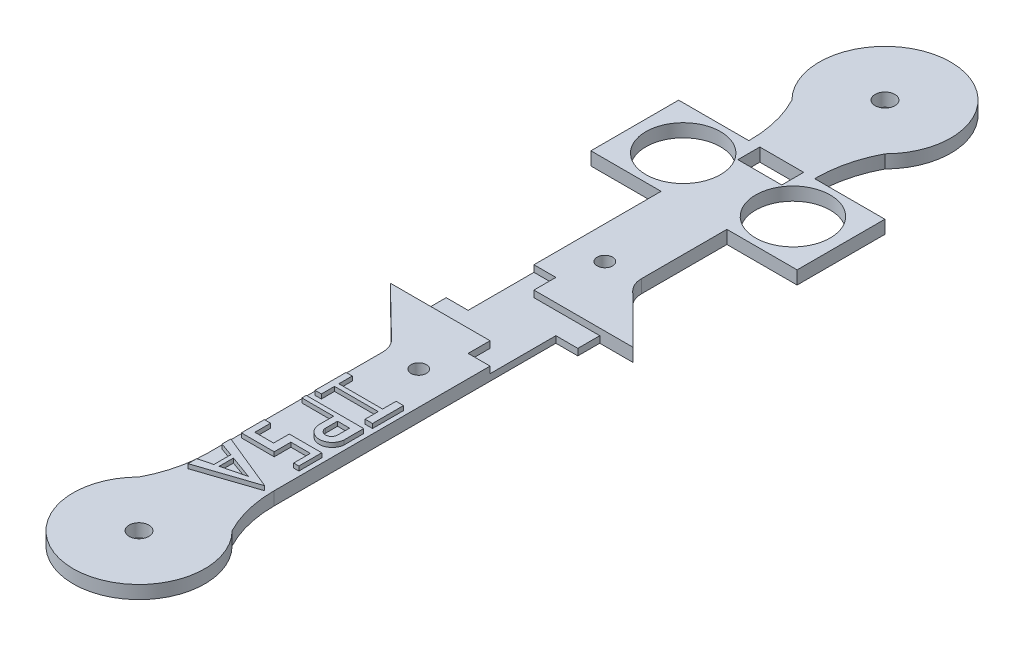
from build123d import *
from build123d.topology import SkipClean

# Parameters (mm, degrees)
SKETCH1_R            = 2
SKETCH1_R_2          = 1.5
BOSS_EXTRUDE2_DEPTH  = 3
SKETCH3_W            = 15.09800494
SKETCH3_H            = 15
CUT_EXTRUDE9_DEPTH   = 1.5
BOSS_EXTRUDE7_DEPTH  = 1.5
BOSS_EXTRUDE9_DEPTH  = 3
SKETCH11_W           = 5
SKETCH11_H           = 5
CUT_EXTRUDE16_DEPTH  = 1.5
SKETCH12_W           = 5
SKETCH12_H           = 5
BOSS_EXTRUDE16_DEPTH = 1.5
BOSS_EXTRUDE17_START = -3
SKETCH15_R           = 1.5
BOSS_EXTRUDE17_DEPTH = 3
SKETCH16_R           = 1.5
CUT_EXTRUDE17_DEPTH  = 103.05738215
BOSS_EXTRUDE23_DEPTH = 1
BOSS_EXTRUDE27_DEPTH = 3
SKETCH27_W           = 5
SKETCH27_H           = 5
CUT_EXTRUDE20_DEPTH  = 3
SKETCH28_R           = 2.25
CUT_EXTRUDE22_DEPTH  = 103.779175528
SKETCH29_R           = 1.75
CUT_EXTRUDE23_DEPTH  = 10


with BuildPart() as part:
    # Sketch1 → Boss-Extrude2 (new body)
    with BuildSketch(Plane(origin=(0, 0, 0), x_dir=(1, 0, 0), z_dir=(0, 1, 0))):
        with BuildLine():
            Line((-7.45099753, -61.780902979), (-7.45099753, 61.780902979))
            ThreePointArc((-7.45099753, 61.780902979), (-8.239083338, 68.275631842), (-10.557599248, 74.393398282))
            ThreePointArc((-10.557599248, 74.393398282), (0.04900247, 100), (10.655604188, 74.393398282))
            ThreePointArc((10.655604188, 74.393398282), (8.337088278, 68.275631842), (7.54900247, 61.780902979))
            Line((7.54900247, 61.780902979), (7.54900247, -61.780902979))
            ThreePointArc((7.54900247, -61.780902979), (8.337088278, -68.275631842), (10.655604188, -74.393398282))
            ThreePointArc((10.655604188, -74.393398282), (0.04900247, -100), (-10.557599248, -74.393398282))
            ThreePointArc((-10.557599248, -74.393398282), (-8.239083338, -68.275631842), (-7.45099753, -61.780902979))
        make_face()
        with Locations(Location((0.04900247, 85, 0), (0, 0, 270))):
            Circle(SKETCH1_R, mode=Mode.SUBTRACT)
        with Locations(Location((0, 20, 0), (0, 0, 270))):
            Circle(SKETCH1_R_2, mode=Mode.SUBTRACT)
        with Locations(Location((0.04900247, -85, 0), (0, 0, 90))):
            Circle(SKETCH1_R, mode=Mode.SUBTRACT)
        with Locations(Location((0, -20, 0), (0, 0, 90))):
            Circle(SKETCH1_R_2, mode=Mode.SUBTRACT)
    extrude(amount=BOSS_EXTRUDE2_DEPTH)

    # Sketch3 → Cut-Extrude9 (cut)
    with BuildSketch(Plane(origin=(0, 3, 0), x_dir=(1, 0, 0), z_dir=(0, 1, 0))):
        Rectangle(SKETCH3_W, SKETCH3_H)
    extrude(amount=-CUT_EXTRUDE9_DEPTH, mode=Mode.SUBTRACT)

    # Sketch4 → Boss-Extrude7 (add, symmetric)
    with BuildSketch(Plane(origin=(0, 1.5, 0), x_dir=(1, 0, 0), z_dir=(0, 1, 0))):
        Polygon((-7.380219176, -20), (-20.167033775, -7.5), (-7.45099753, -7.5), align=None)
        Polygon((7.54900247, 20), (20.167033775, 7.5), (7.54900247, 7.5), align=None)
    extrude(amount=BOSS_EXTRUDE7_DEPTH, both=True)

    # Sketch7 → Boss-Extrude9 (add)
    with BuildSketch(Plane(origin=(0, 3, 0), x_dir=(1, 0, 0), z_dir=(0, 1, 0))):
        with BuildLine():
            Line((-7.45099753, -19.930809239), (-8.881159755, -18.532726263))
            ThreePointArc((-8.881159755, -18.532726263), (-7.823107204, -20.087420247), (-7.45099753, -21.930809239))
            Line((-7.45099753, -21.930809239), (-7.45099753, -19.930809239))
        make_face()
        with BuildLine():
            Line((7.54900247, 20), (7.54900247, 22))
            ThreePointArc((7.54900247, 22), (7.918440774, 20.154044275), (8.969845829, 18.592447462))
            Line((8.969845829, 18.592447462), (7.54900247, 20))
        make_face()
    extrude(amount=-BOSS_EXTRUDE9_DEPTH)

    # Sketch11 → Cut-Extrude16 (cut)
    with BuildSketch(Plane(origin=(0, 3, 0), x_dir=(1, 0, 0), z_dir=(0, 1, 0))):
        with Locations((-4.95099753, 10)):
            Rectangle(SKETCH11_W, SKETCH11_H)
        with Locations((5.04900247, -10)):
            Rectangle(SKETCH11_W, SKETCH11_H)
    extrude(amount=-CUT_EXTRUDE16_DEPTH, mode=Mode.SUBTRACT)

    # Sketch12 → Boss-Extrude16 (add)
    with BuildSketch(Plane(origin=(0, 1.5, 0), x_dir=(1, 0, 0), z_dir=(0, 1, 0))):
        with Locations((-9.95099753, -5)):
            Rectangle(SKETCH12_W, SKETCH12_H)
        with Locations((10.04900247, 5)):
            Rectangle(SKETCH12_W, SKETCH12_H)
    extrude(amount=-BOSS_EXTRUDE16_DEPTH)

    # Sketch15 → Boss-Extrude17 (add)
    with BuildSketch(Plane(origin=(0, 3, 0), x_dir=(1, 0, 0), z_dir=(0, 1, 0)).offset(BOSS_EXTRUDE17_START)):
        with Locations((0, -20)):
            Circle(SKETCH15_R)
        with Locations((0, 20)):
            Circle(SKETCH15_R)
    extrude(amount=BOSS_EXTRUDE17_DEPTH)

    # Sketch16 → Cut-Extrude17 (cut, through all)
    with BuildSketch(Plane(origin=(0, 3, 0), x_dir=(1, 0, 0), z_dir=(0, 1, 0))):
        with Locations(Location((0, -21.2132, 0), (0, 0, 270))):
            Circle(SKETCH16_R)
        with Locations(Location((0, 21.2132, 0), (0, 0, 270))):
            Circle(SKETCH16_R)
    extrude(amount=-CUT_EXTRUDE17_DEPTH, mode=Mode.SUBTRACT)

    # Sketch23 → Boss-Extrude23 (add)
    # profile 1 of 4: a face of its own
    with BuildSketch(Plane(origin=(0, 3, 0), x_dir=(1, 0, 0), z_dir=(0, 1, 0))):
        Polygon((6.48304168, -31.15626819), (4.790546757, -31.15626819), (4.790546757, -34.224668666), (-5.193247077, -34.224668666), (-5.193247077, -31.15626819), (-6.610245289, -31.15626819), (-6.610245289, -38.224668666), (-5.172046476, -38.224668666), (-5.172046476, -35.224668666), (4.790546757, -35.224668666), (4.790546757, -38.224668666), (6.48304168, -38.224668666), align=None)
    # profile 2 of 4: a face of its own
    with BuildSketch(Plane(origin=(0, 3, 0), x_dir=(1, 0, 0), z_dir=(0, 1, 0))):
        with BuildLine():
            Line((6.48304168, -44.774262485), (6.48304168, -40.2287097))
            Line((6.48304168, -40.2287097), (0.613982134, -40.2287097))
            Line((0.613982134, -40.2287097), (-6.610245289, -40.2287097))
            Line((-6.610245289, -40.2287097), (-6.610245289, -41.2287097))
            Line((-6.610245289, -41.2287097), (0.613982134, -41.2287097))
            Line((0.613982134, -41.2287097), (0.613982134, -44.472302349))
            ThreePointArc((0.613982134, -44.472302349), (3.405099993, -47.410713479), (6.48304168, -44.774262485))
        make_face()
        with BuildLine():
            Line((2.048928068, -41.75590566), (4.790546757, -41.75590566))
            Line((4.790546757, -41.75590566), (4.790546757, -44.472302349))
            ThreePointArc((4.790546757, -44.472302349), (3.419737413, -45.843111694), (2.048928068, -44.472302349))
            Line((2.048928068, -44.472302349), (2.048928068, -41.75590566))
        make_face(mode=Mode.SUBTRACT)
    # profile 3 of 4: a face of its own
    with BuildSketch(Plane(origin=(0, 3, 0), x_dir=(1, 0, 0), z_dir=(0, 1, 0))):
        Polygon((-5.193247077, -49.786953251), (-6.610245289, -49.786953251), (-6.610245289, -55.010121906), (0.867065228, -55.010121906), (0.867065228, -51.209269606), (5.304000993, -51.209269606), (5.304000993, -55.010121906), (6.48304168, -55.010121906), (6.48304168, -54.185588488), (6.48304168, -49.786953251), (5.304000993, -49.786953251), (3.675053454, -49.786953251), (-0.919010014, -49.786953251), (-0.919010014, -53.357760144), (-5.193247077, -53.357760144), align=None)
    # profile 4 of 4: a face of its own
    with BuildSketch(Plane(origin=(0, 3, 0), x_dir=(1, 0, 0), z_dir=(0, 1, 0))):
        Polygon((6.48304168, -62.784084555), (-6.610245289, -57.417876571), (-6.610245289, -59.417876571), (-3.495842422, -60.542428347), (-3.495842422, -64.392173355), (-6.610245289, -65.17688806), (-6.610245289, -67.17688806), align=None)
        Polygon((-2.542129921, -64.151872965), (-2.542129921, -60.886795833), (2.783876522, -62.809915692), align=None, mode=Mode.SUBTRACT)
    extrude(amount=BOSS_EXTRUDE23_DEPTH)

    # Sketch18 → Boss-Extrude27 (add)
    with BuildSketch(Plane(origin=(0, 3, 0), x_dir=(1, 0, 0), z_dir=(0, 1, 0))):
        with BuildLine():
            Line((7.54900247, 44.648778007), (7.54900247, 41.473572639))
            Line((7.54900247, 41.473572639), (22.562436554, 41.473572639))
            Line((22.562436554, 41.473572639), (23.549074765, 41.473572639))
            Line((23.549074765, 41.473572639), (23.549074765, 51.473572639))
            Line((23.549074765, 51.473572639), (23.549074765, 61.473572639))
            Line((23.549074765, 61.473572639), (22.562436554, 61.473572639))
            Line((22.562436554, 61.473572639), (7.54900247, 61.473572639))
            Line((7.54900247, 61.473572639), (7.54900247, 58.424486687))
            ThreePointArc((7.54900247, 58.424486687), (16.397137863, 59.105847196), (21.029711515, 51.536632347))
            ThreePointArc((21.029711515, 51.536632347), (16.397137863, 43.967417497), (7.54900247, 44.648778007))
        make_face()
        with BuildLine():
            Line((-22.437563446, 41.473572639), (-7.45099753, 41.473572639))
            Line((-7.45099753, 41.473572639), (-7.45099753, 44.676843358))
            ThreePointArc((-7.45099753, 44.676843358), (-20.970289814, 51.536632347), (-7.45099753, 58.396421335))
            Line((-7.45099753, 58.396421335), (-7.45099753, 61.473572639))
            Line((-7.45099753, 61.473572639), (-22.437563446, 61.473572639))
            Line((-22.437563446, 61.473572639), (-23.450925235, 61.473572639))
            Line((-23.450925235, 61.473572639), (-23.450925235, 41.473572639))
            Line((-23.450925235, 41.473572639), (-22.437563446, 41.473572639))
        make_face()
    extrude(amount=-BOSS_EXTRUDE27_DEPTH)

    # Sketch27 → Cut-Extrude20 (cut)
    with SkipClean():  # the faces are left unmerged after this step: merging them gives an invalid solid
        with BuildSketch(Plane(origin=(0, 3, 0), x_dir=(1, 0, 0), z_dir=(0, 1, 0))):
            with BuildLine():
                ThreePointArc((7.54900247, 44.648778007), (16.397137863, 43.967417497), (21.029711515, 51.536632347))
                ThreePointArc((21.029711515, 51.536632347), (16.397137863, 59.105847196), (7.54900247, 58.424486687))
                Line((7.54900247, 58.424486687), (7.54900247, 44.648778007))
            make_face()
            with BuildLine():
                Line((7.54900247, 44.648778007), (7.54900247, 58.424486687))
                ThreePointArc((7.54900247, 58.424486687), (4.029711515, 51.536632347), (7.54900247, 44.648778007))
            make_face()
            with BuildLine():
                ThreePointArc((-7.45099753, 44.676843358), (-4.890250751, 47.690464411), (-3.970289814, 51.536632347))
                ThreePointArc((-3.970289814, 51.536632347), (-4.890250751, 55.382800283), (-7.45099753, 58.396421335))
                Line((-7.45099753, 58.396421335), (-7.45099753, 44.676843358))
            make_face()
            with BuildLine():
                Line((-7.45099753, 44.676843358), (-7.45099753, 58.396421335))
                ThreePointArc((-7.45099753, 58.396421335), (-20.970289814, 51.536632347), (-7.45099753, 44.676843358))
            make_face()
            with Locations((2.54900247, 58.973572639)):
                Rectangle(SKETCH27_W, SKETCH27_H)
            with Locations((-2.45099753, 58.973572639)):
                Rectangle(SKETCH27_W, SKETCH27_H)
        extrude(amount=-CUT_EXTRUDE20_DEPTH, mode=Mode.SUBTRACT)

    # Sketch28 → Cut-Extrude22 (cut, through all)
    with SkipClean():  # the faces are left unmerged after this step: merging them gives an invalid solid
        with BuildSketch(Plane(origin=(0, 3, 0), x_dir=(1, 0, 0), z_dir=(0, 1, 0))):
            with Locations(Location((0.04900247, 85, 0), (0, 0, 270))):
                Circle(SKETCH28_R)
            with Locations(Location((0.04900247, -85, 0), (0, 0, 270))):
                Circle(SKETCH28_R)
        extrude(amount=-CUT_EXTRUDE22_DEPTH, mode=Mode.SUBTRACT)

    # Sketch29 → Cut-Extrude23 (cut)
    with SkipClean():  # the faces are left unmerged after this step: merging them gives an invalid solid
        with BuildSketch(Plane(origin=(0, 3, 0), x_dir=(1, 0, 0), z_dir=(0, 1, 0))):
            with Locations(Location((0, 21.2132, 0), (0, 0, 270))):
                Circle(SKETCH29_R)
            with Locations(Location((0, -21.2132, 0), (0, 0, 270))):
                Circle(SKETCH29_R)
        extrude(amount=-CUT_EXTRUDE23_DEPTH, mode=Mode.SUBTRACT)


solid = part.part
